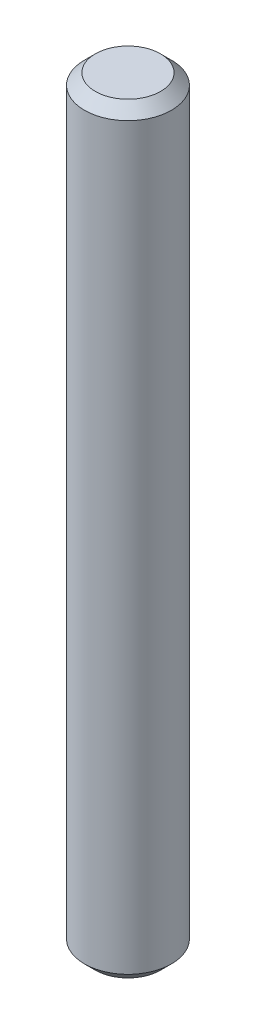
from build123d import *

# Parameters (mm, degrees)
SKETCH_1_R      = 4
EXTRUDE_1_DEPTH = 70
CHAMFER_1_SIZE  = 1


with BuildPart() as part:
    # 草圖1 → 填料-伸長1 (new body)
    with BuildSketch(Plane(origin=(0, 0, 0), x_dir=(1, 0, 0), z_dir=(0, 1, 0))):
        with Locations(Location((0, 0, 0), (0, 0, 270))):
            Circle(SKETCH_1_R)
    extrude(amount=EXTRUDE_1_DEPTH)

    # 導角1
    chamfer_1_edges = [part.edges().sort_by_distance(p)[0] for p in [
        (0, 0, -4),
        (0, 70, -4),
    ]]
    chamfer(chamfer_1_edges, length=CHAMFER_1_SIZE)


solid = part.part
